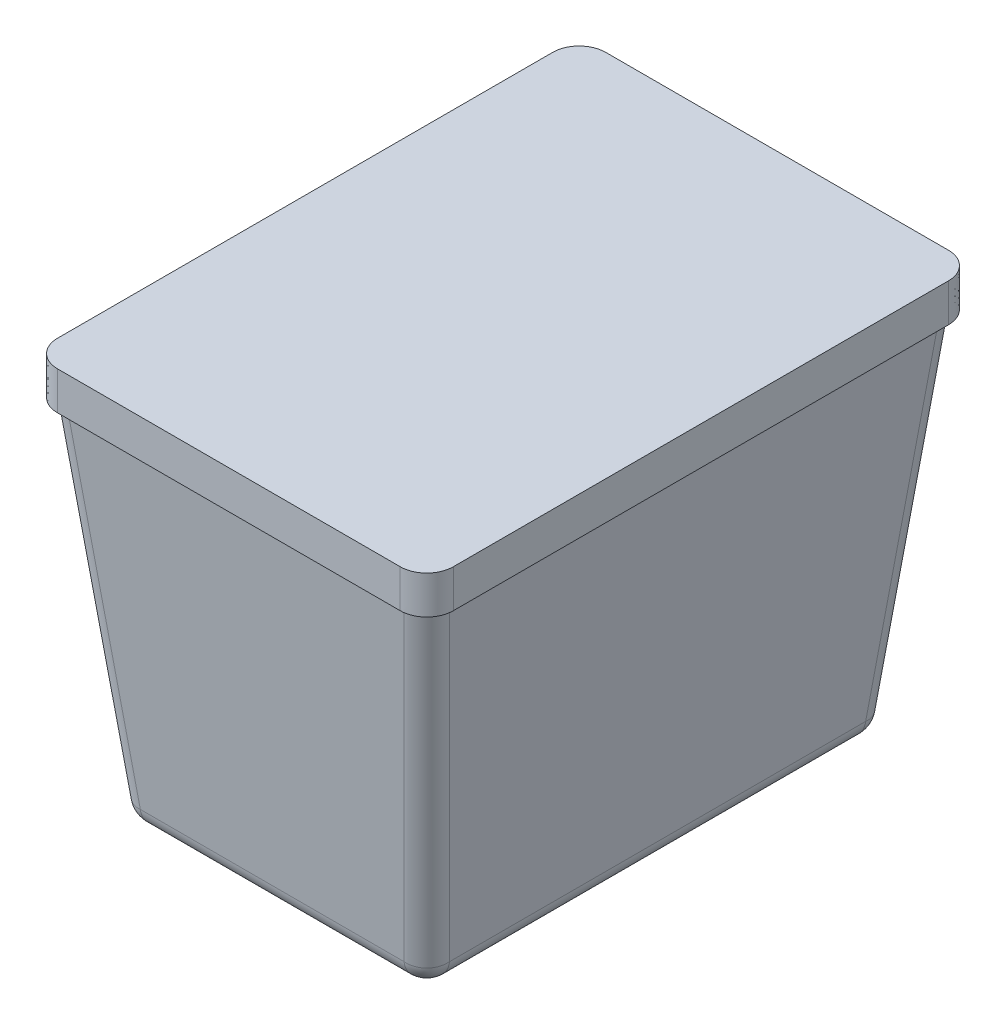
from build123d import *

# Parameters (mm, degrees)
CROQUIS1_W     = 400
CROQUIS1_H     = 600
EXTRUIR1_DEPTH = 520
EXTRUIR1_DRAFT = -6
REDONDEO1_R    = 30
VACIADO1_T     = -10
EXTRUIR2_DEPTH = 40
EXTRUIR3_DEPTH = 10


with BuildPart() as part:
    # Croquis1 → Extruir1 (with draft: the straight prism first)
    with BuildSketch(Plane(origin=(0, 0, 0), x_dir=(1, 0, 0), z_dir=(0, 1, 0))):
        Rectangle(CROQUIS1_W, CROQUIS1_H)
    extrude(amount=EXTRUIR1_DEPTH)
    # Extruir1: the draft: its side faces are tilted about the plane it starts from
    extruir1_sides = [part.faces().sort_by_distance(p)[0] for p in [
        (200, 260, 0),
        (0, 260, -300),
        (-200, 260, 0),
        (0, 260, 300),
    ]]
    draft(extruir1_sides, Plane(origin=(0, 0, 0), x_dir=(1, 0, 0), z_dir=(0, 1, 0)), EXTRUIR1_DRAFT)

    # Redondeo1
    redondeo1_edges = [part.edges().sort_by_distance(p)[0] for p in [
        (0, 0, -300),
        (200, 0, 0),
        (0, 0, 300),
        (-200, 0, 0),
        (-227.327101169, 260, -327.327101169),
        (227.327101169, 260, -327.327101169),
        (227.327101169, 260, 327.327101169),
        (-227.327101169, 260, 327.327101169),
    ]]
    fillet(redondeo1_edges, radius=REDONDEO1_R)

    # Vaciado1
    vaciado1_openings = [part.faces().sort_by_distance(p)[0] for p in [
        (0, 520, 0),
    ]]
    offset(amount=VACIADO1_T, openings=vaciado1_openings, kind=Kind.INTERSECTION)


with BuildPart() as body_2:
    # Croquis2 → Extruir2 (new body)
    with BuildSketch(Plane(origin=(0, 520, 0), x_dir=(1, 0, 0), z_dir=(0, 1, 0))):
        with BuildLine():
            Line((224.818545477, 359.654202338), (-224.818545477, 359.654202338))
            add(Edge.make_bspline(
                [(-224.818545477, 359.654202338), (-227.120086028, 359.654202338), (-229.380934681, 359.430411757), (-232.713747218, 358.773214804), (-233.814869933, 358.500171352), (-235.451518922, 358.007918705), (-235.994558337, 357.830029047), (-237.075507941, 357.446040848), (-237.613820315, 357.239674494), (-240.2615232, 356.148907719), (-242.265343116, 355.081190983), (-245.10317609, 353.193132085), (-246.020940364, 352.51569528), (-247.353923908, 351.425037779), (-247.790551127, 351.049250723), (-248.639460703, 350.281234378), (-249.053000136, 349.888002267), (-251.066995309, 347.87646125), (-252.507863424, 346.123294027), (-254.41183532, 343.276088185), (-255.005828534, 342.285067005), (-256.083159903, 340.267175368), (-256.568789235, 339.23798924), (-257.870403065, 336.091173443), (-258.532675254, 333.914517133), (-259.430368248, 329.399769105), (-259.654202338, 327.120197811), (-259.654202338, 324.818545477)],
                knots=[0, 0, 0, 0, 0.125, 0.125, 0.1875, 0.1875, 0.21875, 0.21875, 0.25, 0.25, 0.375, 0.375, 0.4375, 0.4375, 0.46875, 0.46875, 0.5, 0.5, 0.625, 0.625, 0.6875, 0.6875, 0.75, 0.75, 0.875, 0.875, 1, 1, 1, 1], degree=3))
            Line((-259.654202338, 324.818545477), (-259.654202338, -324.818545477))
            add(Edge.make_bspline(
                [(-259.654202338, -324.818545477), (-259.654202338, -327.120086028), (-259.430411757, -329.380934681), (-258.773214804, -332.713747218), (-258.500171352, -333.814869933), (-258.007918705, -335.451518922), (-257.830029047, -335.994558337), (-257.446040848, -337.075507941), (-257.239674494, -337.613820315), (-256.148907719, -340.2615232), (-255.081190983, -342.265343116), (-253.193132085, -345.10317609), (-252.51569528, -346.020940364), (-251.425037779, -347.353923908), (-251.049250723, -347.790551127), (-250.281234378, -348.639460703), (-249.888002267, -349.053000136), (-247.87646125, -351.066995309), (-246.123294027, -352.507863424), (-243.276088185, -354.41183532), (-242.285067005, -355.005828534), (-240.267175368, -356.083159903), (-239.23798924, -356.568789235), (-236.091173443, -357.870403065), (-233.914517133, -358.532675254), (-229.399769105, -359.430368248), (-227.120197811, -359.654202338), (-224.818545477, -359.654202338)],
                knots=[0, 0, 0, 0, 0.125, 0.125, 0.1875, 0.1875, 0.21875, 0.21875, 0.25, 0.25, 0.375, 0.375, 0.4375, 0.4375, 0.46875, 0.46875, 0.5, 0.5, 0.625, 0.625, 0.6875, 0.6875, 0.75, 0.75, 0.875, 0.875, 1, 1, 1, 1], degree=3))
            Line((-224.818545477, -359.654202338), (224.818545477, -359.654202338))
            add(Edge.make_bspline(
                [(224.818545477, -359.654202338), (227.120086028, -359.654202338), (229.380934681, -359.430411757), (232.713747218, -358.773214804), (233.814869933, -358.500171352), (235.451518922, -358.007918705), (235.994558337, -357.830029047), (237.075507941, -357.446040848), (237.613820315, -357.239674494), (240.2615232, -356.148907719), (242.265343116, -355.081190983), (245.10317609, -353.193132085), (246.020940364, -352.51569528), (247.353923908, -351.425037779), (247.790551127, -351.049250723), (248.639460703, -350.281234378), (249.053000136, -349.888002267), (251.066995309, -347.87646125), (252.507863424, -346.123294027), (254.41183532, -343.276088185), (255.005828534, -342.285067005), (256.083159903, -340.267175368), (256.568789235, -339.23798924), (257.870403065, -336.091173443), (258.532675254, -333.914517133), (259.430368248, -329.399769105), (259.654202338, -327.120197811), (259.654202338, -324.818545477)],
                knots=[0, 0, 0, 0, 0.125, 0.125, 0.1875, 0.1875, 0.21875, 0.21875, 0.25, 0.25, 0.375, 0.375, 0.4375, 0.4375, 0.46875, 0.46875, 0.5, 0.5, 0.625, 0.625, 0.6875, 0.6875, 0.75, 0.75, 0.875, 0.875, 1, 1, 1, 1], degree=3))
            Line((259.654202338, -324.818545477), (259.654202338, 324.818545477))
            add(Edge.make_bspline(
                [(259.654202338, 324.818545477), (259.654202338, 327.120086028), (259.430411757, 329.380934681), (258.773214804, 332.713747218), (258.500171352, 333.814869933), (258.007918705, 335.451518922), (257.830029047, 335.994558337), (257.446040848, 337.075507941), (257.239674494, 337.613820315), (256.148907719, 340.2615232), (255.081190983, 342.265343116), (253.193132085, 345.10317609), (252.51569528, 346.020940364), (251.425037779, 347.353923908), (251.049250723, 347.790551127), (250.281234378, 348.639460703), (249.888002267, 349.053000136), (247.87646125, 351.066995309), (246.123294027, 352.507863424), (243.276088185, 354.41183532), (242.285067005, 355.005828534), (240.267175368, 356.083159903), (239.23798924, 356.568789235), (236.091173443, 357.870403065), (233.914517133, 358.532675254), (229.399769105, 359.430368248), (227.120197811, 359.654202338), (224.818545477, 359.654202338)],
                knots=[0, 0, 0, 0, 0.125, 0.125, 0.1875, 0.1875, 0.21875, 0.21875, 0.25, 0.25, 0.375, 0.375, 0.4375, 0.4375, 0.46875, 0.46875, 0.5, 0.5, 0.625, 0.625, 0.6875, 0.6875, 0.75, 0.75, 0.875, 0.875, 1, 1, 1, 1], degree=3))
        make_face()
    extrude(amount=-EXTRUIR2_DEPTH)

    # Croquis3 → Extruir3 (add)
    with BuildSketch(Plane(origin=(0, 520, 0), x_dir=(1, 0, 0), z_dir=(0, 1, 0))):
        with BuildLine():
            Line((-259.654202338, 324.818545477), (-259.654202338, -324.818545477))
            add(Edge.make_bspline(
                [(-259.654202338, -324.818545477), (-259.654202338, -327.120086028), (-259.430411757, -329.380934681), (-258.773214804, -332.713747218), (-258.500171352, -333.814869933), (-258.007918705, -335.451518922), (-257.830029047, -335.994558337), (-257.446040848, -337.075507941), (-257.239674494, -337.613820315), (-256.148907719, -340.2615232), (-255.081190983, -342.265343116), (-253.193132085, -345.10317609), (-252.51569528, -346.020940364), (-251.425037779, -347.353923908), (-251.049250723, -347.790551127), (-250.281234378, -348.639460703), (-249.888002267, -349.053000136), (-247.87646125, -351.066995309), (-246.123294027, -352.507863424), (-243.276088185, -354.41183532), (-242.285067005, -355.005828534), (-240.267175368, -356.083159903), (-239.23798924, -356.568789235), (-236.091173443, -357.870403065), (-233.914517133, -358.532675254), (-229.399769105, -359.430368248), (-227.120197811, -359.654202338), (-224.818545477, -359.654202338)],
                knots=[0, 0, 0, 0, 0.125, 0.125, 0.1875, 0.1875, 0.21875, 0.21875, 0.25, 0.25, 0.375, 0.375, 0.4375, 0.4375, 0.46875, 0.46875, 0.5, 0.5, 0.625, 0.625, 0.6875, 0.6875, 0.75, 0.75, 0.875, 0.875, 1, 1, 1, 1], degree=3))
            Line((-224.818545477, -359.654202338), (224.818545477, -359.654202338))
            add(Edge.make_bspline(
                [(224.818545477, -359.654202338), (227.120086028, -359.654202338), (229.380934681, -359.430411757), (232.713747218, -358.773214804), (233.814869933, -358.500171352), (235.451518922, -358.007918705), (235.994558337, -357.830029047), (237.075507941, -357.446040848), (237.613820315, -357.239674494), (240.2615232, -356.148907719), (242.265343116, -355.081190983), (245.10317609, -353.193132085), (246.020940364, -352.51569528), (247.353923908, -351.425037779), (247.790551127, -351.049250723), (248.639460703, -350.281234378), (249.053000136, -349.888002267), (251.066995309, -347.87646125), (252.507863424, -346.123294027), (254.41183532, -343.276088185), (255.005828534, -342.285067005), (256.083159903, -340.267175368), (256.568789235, -339.23798924), (257.870403065, -336.091173443), (258.532675254, -333.914517133), (259.430368248, -329.399769105), (259.654202338, -327.120197811), (259.654202338, -324.818545477)],
                knots=[0, 0, 0, 0, 0.125, 0.125, 0.1875, 0.1875, 0.21875, 0.21875, 0.25, 0.25, 0.375, 0.375, 0.4375, 0.4375, 0.46875, 0.46875, 0.5, 0.5, 0.625, 0.625, 0.6875, 0.6875, 0.75, 0.75, 0.875, 0.875, 1, 1, 1, 1], degree=3))
            Line((259.654202338, -324.818545477), (259.654202338, 324.818545477))
            add(Edge.make_bspline(
                [(259.654202338, 324.818545477), (259.654202338, 327.120086028), (259.430411757, 329.380934681), (258.773214804, 332.713747218), (258.500171352, 333.814869933), (258.007918705, 335.451518922), (257.830029047, 335.994558337), (257.446040848, 337.075507941), (257.239674494, 337.613820315), (256.148907719, 340.2615232), (255.081190983, 342.265343116), (253.193132085, 345.10317609), (252.51569528, 346.020940364), (251.425037779, 347.353923908), (251.049250723, 347.790551127), (250.281234378, 348.639460703), (249.888002267, 349.053000136), (247.87646125, 351.066995309), (246.123294027, 352.507863424), (243.276088185, 354.41183532), (242.285067005, 355.005828534), (240.267175368, 356.083159903), (239.23798924, 356.568789235), (236.091173443, 357.870403065), (233.914517133, 358.532675254), (229.399769105, 359.430368248), (227.120197811, 359.654202338), (224.818545477, 359.654202338)],
                knots=[0, 0, 0, 0, 0.125, 0.125, 0.1875, 0.1875, 0.21875, 0.21875, 0.25, 0.25, 0.375, 0.375, 0.4375, 0.4375, 0.46875, 0.46875, 0.5, 0.5, 0.625, 0.625, 0.6875, 0.6875, 0.75, 0.75, 0.875, 0.875, 1, 1, 1, 1], degree=3))
            Line((224.818545477, 359.654202338), (-224.818545477, 359.654202338))
            add(Edge.make_bspline(
                [(-224.818545477, 359.654202338), (-227.120086028, 359.654202338), (-229.380934681, 359.430411757), (-232.713747218, 358.773214804), (-233.814869933, 358.500171352), (-235.451518922, 358.007918705), (-235.994558337, 357.830029047), (-237.075507941, 357.446040848), (-237.613820315, 357.239674494), (-240.2615232, 356.148907719), (-242.265343116, 355.081190983), (-245.10317609, 353.193132085), (-246.020940364, 352.51569528), (-247.353923908, 351.425037779), (-247.790551127, 351.049250723), (-248.639460703, 350.281234378), (-249.053000136, 349.888002267), (-251.066995309, 347.87646125), (-252.507863424, 346.123294027), (-254.41183532, 343.276088185), (-255.005828534, 342.285067005), (-256.083159903, 340.267175368), (-256.568789235, 339.23798924), (-257.870403065, 336.091173443), (-258.532675254, 333.914517133), (-259.430368248, 329.399769105), (-259.654202338, 327.120197811), (-259.654202338, 324.818545477)],
                knots=[0, 0, 0, 0, 0.125, 0.125, 0.1875, 0.1875, 0.21875, 0.21875, 0.25, 0.25, 0.375, 0.375, 0.4375, 0.4375, 0.46875, 0.46875, 0.5, 0.5, 0.625, 0.625, 0.6875, 0.6875, 0.75, 0.75, 0.875, 0.875, 1, 1, 1, 1], degree=3))
        make_face()
    extrude(amount=EXTRUIR3_DEPTH)


solid = Compound([part.part, body_2.part])
